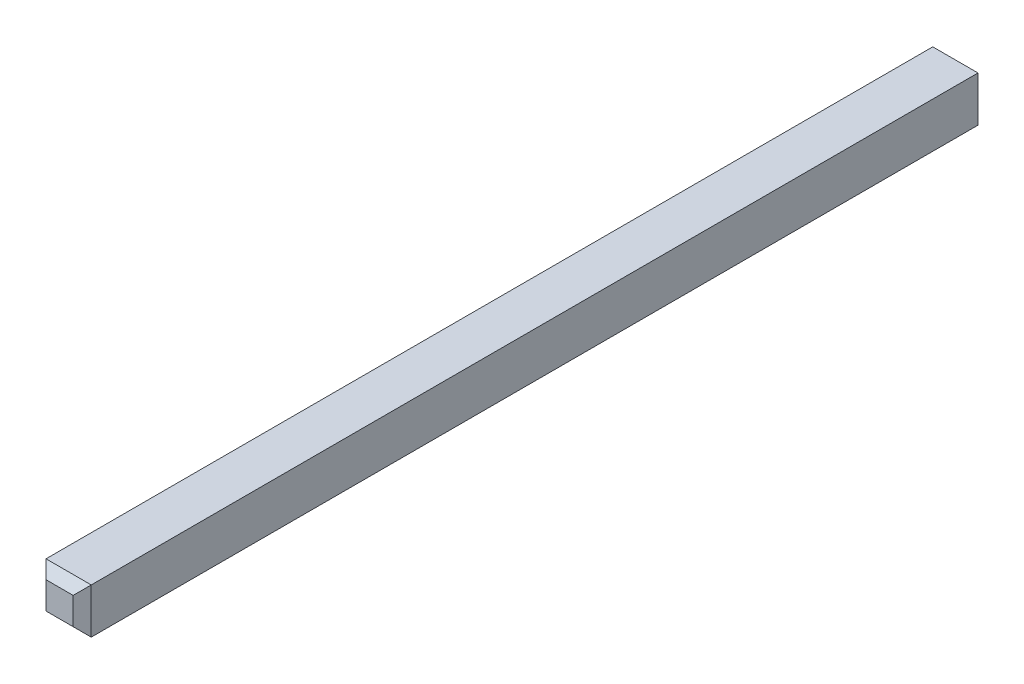
from build123d import *

# Parameters (mm, degrees)
SKETCH_1_W      = 0.5
SKETCH_1_H      = 0.5
EXTRUDE_1_DEPTH = 10
CHAMFER_1_SIZE  = 0.1


with BuildPart() as part:
    # 草图1 → 凸台-拉伸1 (new body)
    with BuildSketch(Plane.XY):
        Rectangle(SKETCH_1_W, SKETCH_1_H)
    extrude(amount=EXTRUDE_1_DEPTH)

    # 倒角1
    chamfer_1_edges = [part.edges().sort_by_distance(p)[0] for p in [
        (-0.25, 0, 10),
        (0, -0.25, 10),
        (0.25, 0, 10),
        (0, -0.25, 0),
        (-0.25, 0, 0),
        (0, 0.25, 0),
        (0.25, 0, 0),
        (0, 0.25, 10),
    ]]
    chamfer(chamfer_1_edges, length=CHAMFER_1_SIZE)


solid = part.part
